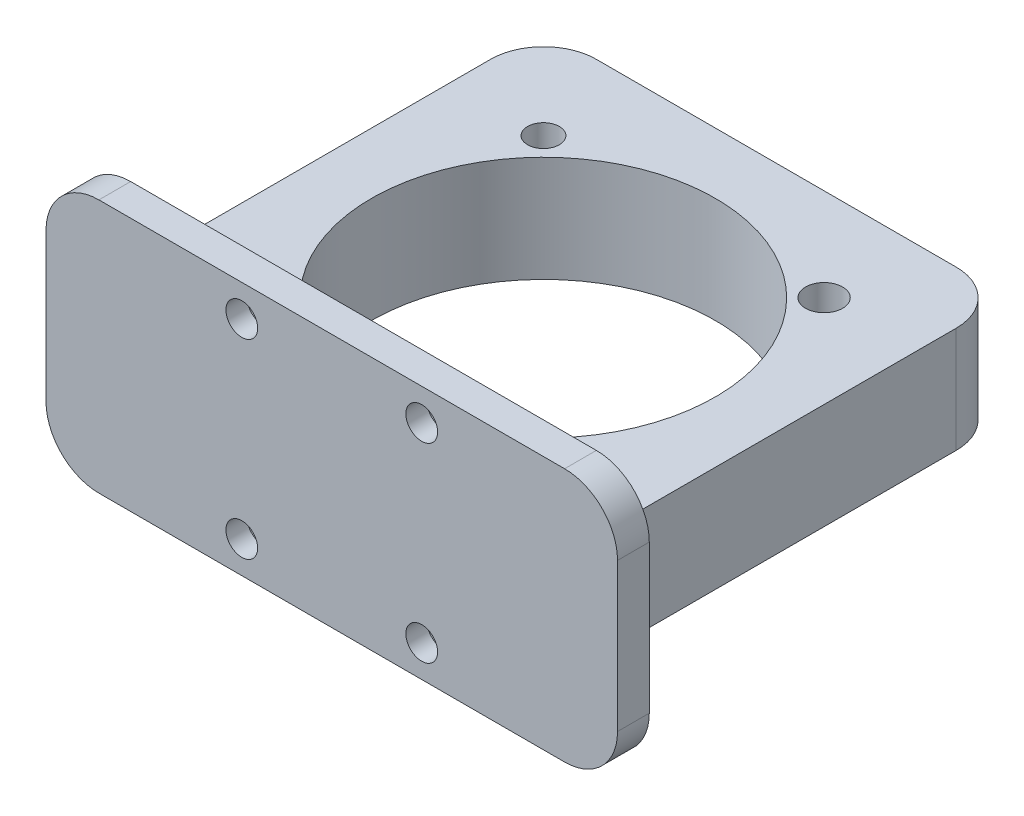
from build123d import *

# Parameters (mm, degrees)
SKETCH_1_W               = 34
SKETCH_1_H               = 34
SKETCH_1_R               = 16.25
SKETCH_1_R_2             = 1.75
SKETCH_1_R_3             = 1.5
EXTRUDE_1_DEPTH          = 5
SKETCH_2_W               = 34
SKETCH_2_H               = 3
EXTRUDE_2_DEPTH          = 12
SKETCH_5_R               = 1.5
CUT_EXTRUDE_4_DEPTH      = 29.861739379
SKETCH_16_W              = 34
SKETCH_16_H              = 10
EXTRUDE_4_DEPTH          = 5
SKETCH_17_W              = 39
SKETCH_17_H              = 5
EXTRUDE_5_DEPTH          = 5
SKETCH_20_W              = 5
SKETCH_20_H              = 39
EXTRUDE_6_DEPTH          = 5
SKETCH_22_W              = 5
SKETCH_22_H              = 39
EXTRUDE_7_DEPTH          = 5
SKETCH_25_W              = 34
SKETCH_25_H              = 3
EXTRUDE_8_DEPTH          = 12
SKETCH_26_W              = 3
SKETCH_26_H              = 24
EXTRUDE_9_DEPTH          = 10
FILLET_1_R               = 5
FILLET_2_R               = 5
SKETCH_27_R              = 1.5
CUT_EXTRUDE_10_DEPTH     = 49.928519291
SKETCH_29_R              = 2
CUT_EXTRUDE_11_DEPTH     = 1
MIRROR_4_COPY_1_SKETCH_R = 1.5
MIRROR_4_COPY_1_DEPTH    = 49.928519291
MIRROR_4_COPY_2_SKETCH_R = 2
MIRROR_4_COPY_2_DEPTH    = 1


with BuildPart() as part:
    # 草图1 → 凸台-拉伸1 (new, symmetric)
    with BuildSketch(Plane(origin=(0, 0, 0), x_dir=(1, 0, 0), z_dir=(0, 1, 0))):
        Rectangle(SKETCH_1_W, SKETCH_1_H)
        with Locations(Location((0, 0, 0), (0, 0, 270))):
            Circle(SKETCH_1_R, mode=Mode.SUBTRACT)
        with Locations(Location((13.258252147, 13.258252147, 0), (0, 0, 270))):
            Circle(SKETCH_1_R_2, mode=Mode.SUBTRACT)
        with Locations(Location((13.258252147, -13.258252147, 0), (0, 0, 270))):
            Circle(SKETCH_1_R_3, mode=Mode.SUBTRACT)
        with Locations(Location((-13.258252147, 13.258252147, 0), (0, 0, 270))):
            Circle(SKETCH_1_R_3, mode=Mode.SUBTRACT)
        with Locations(Location((-13.258252147, -13.258252147, 0), (0, 0, 270))):
            Circle(SKETCH_1_R_2, mode=Mode.SUBTRACT)
    extrude(amount=EXTRUDE_1_DEPTH, both=True)

    # 草图2 → 凸台-拉伸2 (add)
    with BuildSketch(Plane(origin=(0, 0, 0), x_dir=(1, 0, 0), z_dir=(0, 1, 0))):
        with Locations((0, -18.5)):
            Rectangle(SKETCH_2_W, SKETCH_2_H)
    extrude(amount=EXTRUDE_2_DEPTH)

    # 草图5 → 切除-拉伸4 (cut, through all)
    with BuildSketch(Plane.XY):
        with Locations((-8.5, 9)):
            Circle(SKETCH_5_R)
        with Locations(Location((8.5, 9, 0), (0, 0, 180))):
            Circle(SKETCH_5_R)
    extrude(amount=CUT_EXTRUDE_4_DEPTH, mode=Mode.SUBTRACT)

    # 草图16 → 凸台-拉伸4 (add)
    with BuildSketch(Plane(origin=(0, 0, -17), x_dir=(-1, 0, 0), z_dir=(0, 0, -1))):
        Rectangle(SKETCH_16_W, SKETCH_16_H)
    extrude(amount=EXTRUDE_4_DEPTH)

    # 草图17 → 凸台-拉伸5 (add)
    with BuildSketch(Plane.ZY.offset(17)):
        with Locations((-2.5, 2.5)):
            Rectangle(SKETCH_17_W, SKETCH_17_H)
    extrude_5 = extrude(amount=EXTRUDE_5_DEPTH)

    # 镜向1: 凸台-拉伸5 across plane
    add(extrude_5.mirror(Plane(origin=(0, 0, 0), x_dir=(0, 0, 1), z_dir=(1, 0, 0))))

    # 草图20 → 凸台-拉伸6 (add, symmetric)
    with BuildSketch(Plane.XZ):
        with Locations((-19.5, -2.5)):
            Rectangle(SKETCH_20_W, SKETCH_20_H)
    extrude(amount=EXTRUDE_6_DEPTH, both=True)

    # 草图22 → 凸台-拉伸7 (add, symmetric)
    with BuildSketch(Plane.XZ):
        with Locations((19.5, -2.5)):
            Rectangle(SKETCH_22_W, SKETCH_22_H)
    extrude(amount=EXTRUDE_7_DEPTH, both=True)

    # 草图25 → 凸台-拉伸8 (add, symmetric)
    with BuildSketch(Plane.XZ):
        with Locations((0, 18.5)):
            Rectangle(SKETCH_25_W, SKETCH_25_H)
    extrude(amount=EXTRUDE_8_DEPTH, both=True)

    # 草图26 → 凸台-拉伸9 (add)
    with BuildSketch(Plane.ZY.offset(17)):
        with Locations((18.5, 0)):
            Rectangle(SKETCH_26_W, SKETCH_26_H)
    extrude_9 = extrude(amount=EXTRUDE_9_DEPTH)

    # 镜向2: 凸台-拉伸9 across plane
    add(extrude_9.mirror(Plane(origin=(0, 0, 0), x_dir=(0, 0, 1), z_dir=(1, 0, 0))))

    # 圆角1
    fillet_1_edges = [part.edges().sort_by_distance(p)[0] for p in [
        (-22, 0, -22),
        (22, 0, -22),
    ]]
    fillet(fillet_1_edges, radius=FILLET_1_R)

    # 圆角2
    fillet_2_edges = [part.edges().sort_by_distance(p)[0] for p in [
        (-27, -12, 18.5),
        (-27, 12, 18.5),
        (27, 12, 18.5),
        (27, -12, 18.5),
    ]]
    fillet(fillet_2_edges, radius=FILLET_2_R)

    # 草图27 → 切除-拉伸10 (cut, through all)
    with BuildSketch(Plane(origin=(0, 0, 17), x_dir=(-1, 0, 0), z_dir=(0, 0, -1))):
        with Locations((8.5, -9)):
            Circle(SKETCH_27_R)
    cut_extrude_10 = extrude(amount=-CUT_EXTRUDE_10_DEPTH, mode=Mode.SUBTRACT)

    # 草图29 → 切除-拉伸11 (cut)
    with BuildSketch(Plane(origin=(0, 0, 17), x_dir=(-1, 0, 0), z_dir=(0, 0, -1))):
        with Locations((8.5, -9)):
            Circle(SKETCH_29_R)
    cut_extrude_11 = extrude(amount=-CUT_EXTRUDE_11_DEPTH, mode=Mode.SUBTRACT)

    # 镜向3: 切除-拉伸10, 切除-拉伸11 across plane
    add(cut_extrude_10.mirror(Plane(origin=(0, 0, 0), x_dir=(0, 0, 1), z_dir=(1, 0, 0))), mode=Mode.SUBTRACT)
    add(cut_extrude_11.mirror(Plane(origin=(0, 0, 0), x_dir=(0, 0, 1), z_dir=(1, 0, 0))), mode=Mode.SUBTRACT)

    # 镜向4: 切除-拉伸10, 切除-拉伸11 across plane
    add(cut_extrude_10.mirror(Plane.ZX), mode=Mode.SUBTRACT)
    add(cut_extrude_11.mirror(Plane.ZX), mode=Mode.SUBTRACT)

    # 镜向4 copy 1 sketch → 镜向4 copy 1 (cut, through all)
    with BuildSketch(Plane(origin=(0, 0, 17), x_dir=(1, 0, 0), z_dir=(0, 0, -1))):
        with Locations((8.5, -9)):
            Circle(MIRROR_4_COPY_1_SKETCH_R)
    extrude(amount=-MIRROR_4_COPY_1_DEPTH, mode=Mode.SUBTRACT)

    # 镜向4 copy 2 sketch → 镜向4 copy 2 (cut)
    with BuildSketch(Plane(origin=(0, 0, 17), x_dir=(1, 0, 0), z_dir=(0, 0, -1))):
        with Locations((8.5, -9)):
            Circle(MIRROR_4_COPY_2_SKETCH_R)
    extrude(amount=-MIRROR_4_COPY_2_DEPTH, mode=Mode.SUBTRACT)


solid = part.part
